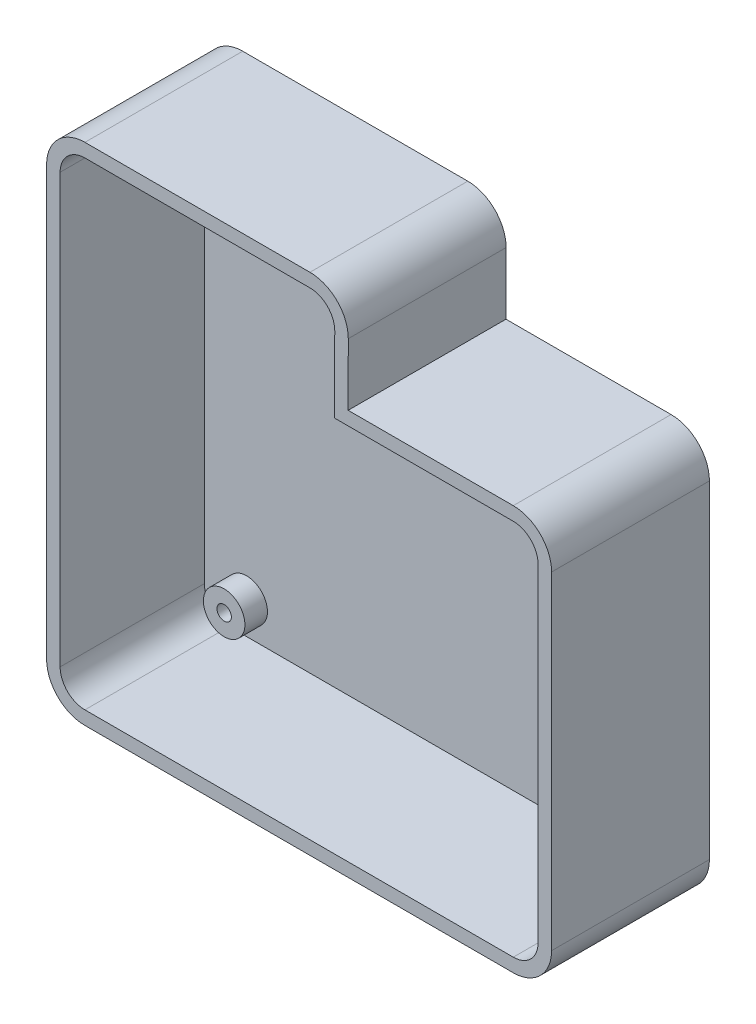
from build123d import *

# Parameters (mm, degrees)
SKETCH1_R           = 1.6
BOSS_EXTRUDE1_DEPTH = 35
SHELL3_T            = -3
CUT_EXTRUDE2_DEPTH  = 27


with BuildPart() as part:
    # Sketch1 → Boss-Extrude1 (new body)
    with BuildSketch(Plane.XY):
        with BuildLine():
            Line((41.47958643, 169.703196001), (-8.43041357, 169.703196001))
            ThreePointArc((-8.43041357, 169.703196001), (-14.44082121, 167.213603641), (-16.93041357, 161.203196001))
            Line((-16.93041357, 161.203196001), (-16.93041357, 66.203196001))
            ThreePointArc((-16.93041357, 66.203196001), (-14.44082121, 60.192788361), (-8.43041357, 57.703196001))
            Line((-8.43041357, 57.703196001), (86.56958643, 57.703196001))
            ThreePointArc((86.56958643, 57.703196001), (92.57999407, 60.192788361), (95.06958643, 66.203196001))
            Line((95.06958643, 66.203196001), (95.06958643, 138.923196001))
            ThreePointArc((95.06958643, 138.923196001), (92.57999407, 144.933603641), (86.56958643, 147.423196001))
            Line((86.56958643, 147.423196001), (84.57958643, 147.423196001))
            Line((84.57958643, 147.423196001), (78.22958643, 147.423196001))
            Line((78.22958643, 147.423196001), (56.63958643, 147.423196001))
            Line((56.63958643, 147.423196001), (50.28958643, 147.423196001))
            Line((50.28958643, 147.423196001), (49.947630422, 147.423196001))
            Line((49.947630422, 147.423196001), (49.97958643, 161.203196001))
            ThreePointArc((49.97958643, 161.203196001), (47.48999407, 167.213603641), (41.47958643, 169.703196001))
        make_face()
        with Locations((-1.583516975, 154.760976138)):
            Circle(SKETCH1_R, mode=Mode.SUBTRACT)
        with Locations((38.108590224, 155.552573365)):
            Circle(SKETCH1_R, mode=Mode.SUBTRACT)
        with Locations((-4.549842033, 67.784537285)):
            Circle(SKETCH1_R, mode=Mode.SUBTRACT)
        with Locations((76.81802316, 70.207451643)):
            Circle(SKETCH1_R, mode=Mode.SUBTRACT)
    extrude(amount=BOSS_EXTRUDE1_DEPTH)

    # Shell3
    shell3_openings = [part.faces().sort_by_distance(p)[0] for p in [
        (36.150005596, 109.720855489, 35),
    ]]
    offset(amount=SHELL3_T, openings=shell3_openings, kind=Kind.INTERSECTION)

    # Sketch4 → Cut-Extrude2 (cut)
    with BuildSketch(Plane.XY.offset(35)):
        with BuildLine():
            Line((41.47958643, 164.703196001), (-8.43041357, 164.703196001))
            ThreePointArc((-8.43041357, 164.703196001), (-10.905287304, 163.678069735), (-11.93041357, 161.203196001))
            Line((-11.93041357, 161.203196001), (-11.93041357, 66.203196001))
            ThreePointArc((-11.93041357, 66.203196001), (-10.905287304, 63.728322267), (-8.43041357, 62.703196001))
            Line((-8.43041357, 62.703196001), (86.56958643, 62.703196001))
            ThreePointArc((86.56958643, 62.703196001), (89.044460164, 63.728322267), (90.06958643, 66.203196001))
            Line((90.06958643, 66.203196001), (90.06958643, 138.923196001))
            ThreePointArc((90.06958643, 138.923196001), (89.044460164, 141.398069735), (86.56958643, 142.423196001))
            Line((86.56958643, 142.423196001), (44.936021909, 142.423196001))
            Line((44.936021909, 142.423196001), (44.979583495, 161.207728174))
            ThreePointArc((44.979583495, 161.207728174), (43.95285728, 163.679671582), (41.47958643, 164.703196001))
        make_face()
    extrude(amount=-CUT_EXTRUDE2_DEPTH, mode=Mode.SUBTRACT)


solid = part.part
